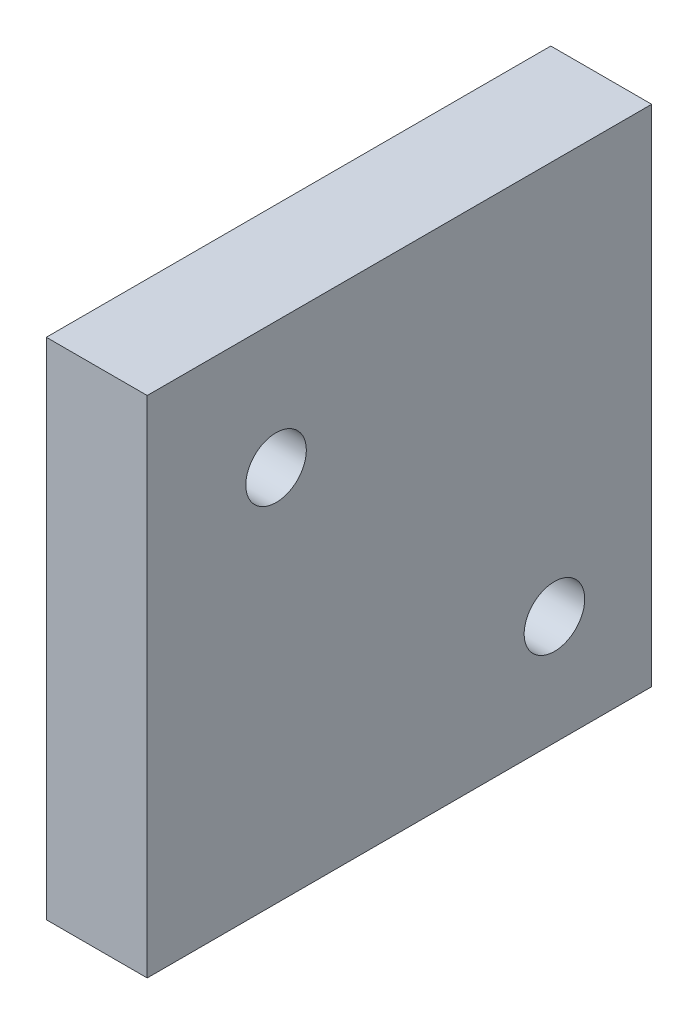
from build123d import *

# Parameters (mm, degrees)
SKETCH1_W                  = 100
SKETCH1_H                  = 100
BOSS_EXTRUDE1_DEPTH        = 20
F_12_0_12_DIAMETER_HOLE1_D = 12


with BuildPart() as part:
    # Sketch1 → Boss-Extrude1 (new body)
    with BuildSketch(Plane.YZ):
        with Locations((-35.882153033, 4.744525547)):
            Rectangle(SKETCH1_W, SKETCH1_H)
    extrude(amount=BOSS_EXTRUDE1_DEPTH)

    # Ø12.0 (12) Diameter Hole1 (through all)
    with Locations(Plane.YZ.offset(20)):
        with Locations((-11.034254012, 29.200501871), (-64.178971791, -25.982213935)):
            Hole(F_12_0_12_DIAMETER_HOLE1_D / 2)


solid = part.part
